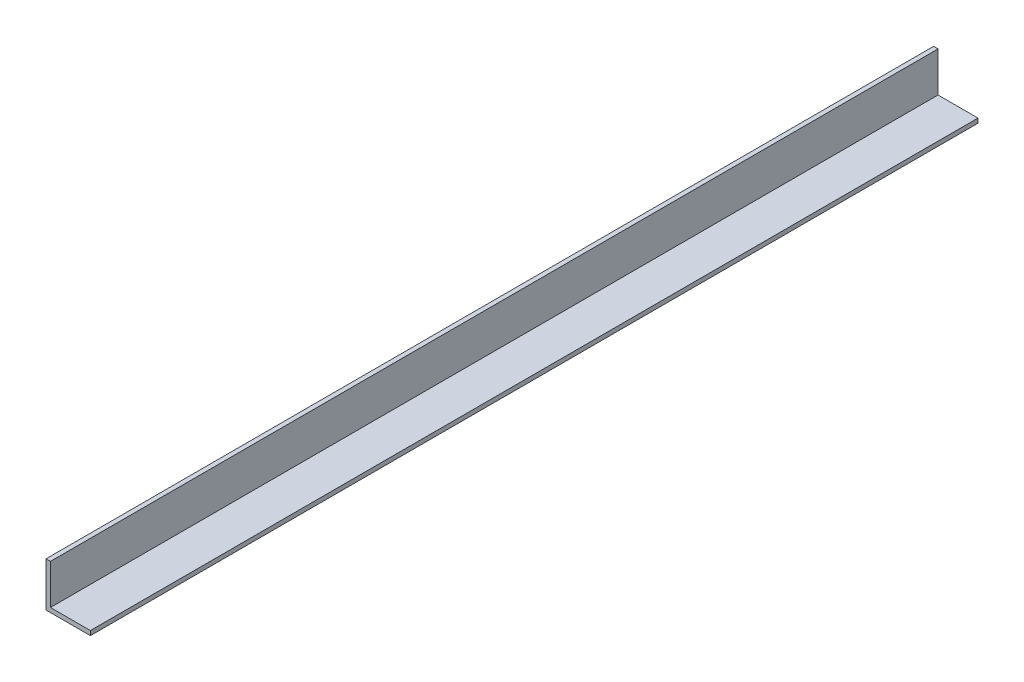
from build123d import *

# Parameters (mm, degrees)
BOSS_EXTRUDE1_DEPTH = 300


with BuildPart() as part:
    # Sketch1 → Boss-Extrude1 (new body)
    with BuildSketch(Plane.XY):
        Polygon((0, 0), (15, 0), (15, 1.5), (1.5, 1.5), (1.5, 15), (0, 15), align=None)
    extrude(amount=BOSS_EXTRUDE1_DEPTH)


solid = part.part
